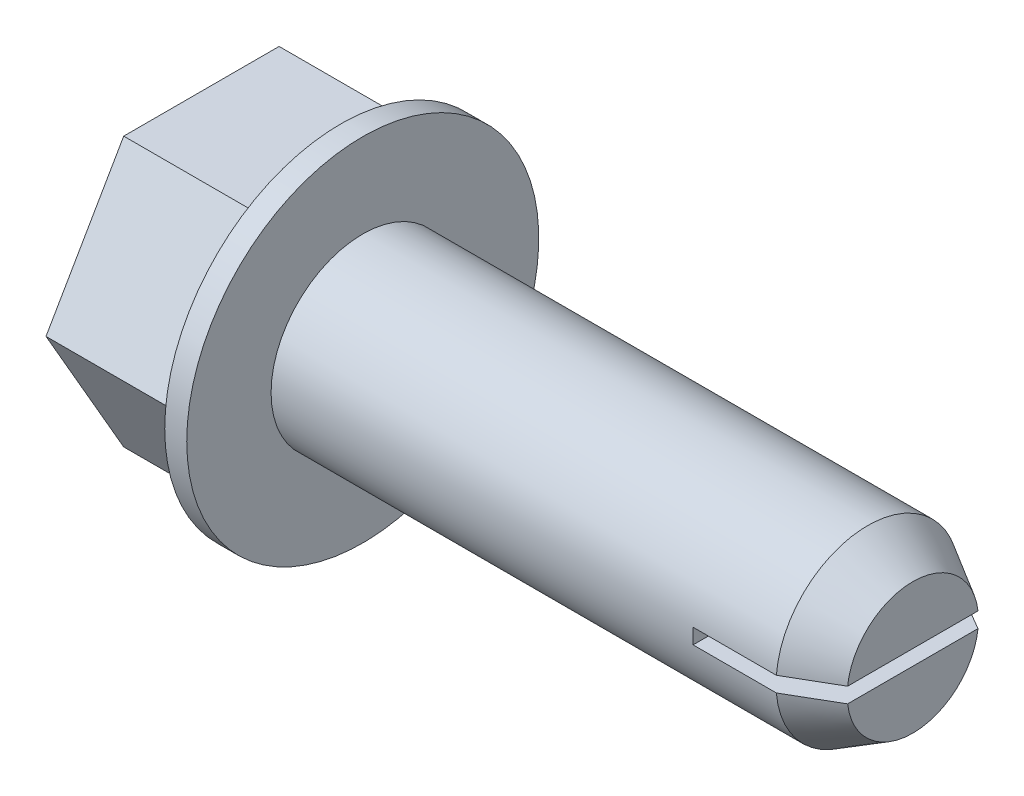
from build123d import *

# Parameters (mm, degrees)
EXTRUDE1_REACH                 = 28.103
POINT_CUT_EXTRUDE10_DEPTH      = 21.909924247
POINT_CUT_EXTRUDE10_DEPTH_BACK = 21.909924247
SKETCH13_W                     = 4.445
SKETCH13_H                     = 0.529166666


with BuildPart() as part:
    # Sketch1 → base-Revolve (revolve)
    with BuildSketch(Plane.XY, mode=Mode.PRIVATE) as base_revolve_sk:
        Polygon((0, 6.096), (-0.762, 6.096), (-0.762, 4.6609), (-5.588, 4.6609), (-5.588, 3.72872), (-4.6228, 3.72872), (-4.6228, 0), (0, 0), (19.05, 0), (19.05, 3.175), (0, 3.175), align=None)
    revolve(base_revolve_sk.sketch.rotate(Axis((0, 0, 0), (1, 0, 0)), 90), axis=Axis((0, 0, 0), (1, 0, 0)))

    # Sketch15 → Extrude1 (add, up to next)
    with BuildSketch(Plane.ZY.offset(5.588), mode=Mode.PRIVATE) as extrude1_sk1:
        with BuildLine():
            ThreePointArc((-4.036457824, -2.330449967), (-4.6609, 3.6e-08), (-4.036457787, 2.33045003))
            Line((-4.036457787, 2.33045003), (-5.381943739, 0))
            Line((-5.381943739, 0), (-4.036457824, -2.330449967))
        make_face()
    extrude1_tool1 = extrude(extrude1_sk1.sketch, amount=-EXTRUDE1_REACH, mode=Mode.PRIVATE) - part.part
    # Sketch15 → Extrude1 (add, up to next)
    with BuildSketch(Plane.ZY.offset(5.588), mode=Mode.PRIVATE) as extrude1_sk2:
        with BuildLine():
            ThreePointArc((-4.036457787, 2.33045003), (-2.330449985, 4.036457813), (0, 4.6609))
            Line((0, 4.6609), (-2.69097187, 4.6609))
            Line((-2.69097187, 4.6609), (-4.036457787, 2.33045003))
        make_face()
    extrude1_tool2 = extrude(extrude1_sk2.sketch, amount=-EXTRUDE1_REACH, mode=Mode.PRIVATE) - part.part
    # Sketch15 → Extrude1 (add, up to next)
    with BuildSketch(Plane.ZY.offset(5.588), mode=Mode.PRIVATE) as extrude1_sk3:
        with BuildLine():
            ThreePointArc((0, 4.6609), (2.330450001, 4.036457804), (4.036457805, 2.330449998))
            Line((4.036457805, 2.330449998), (2.69097187, 4.6609))
            Line((2.69097187, 4.6609), (0, 4.6609))
        make_face()
    extrude1_tool3 = extrude(extrude1_sk3.sketch, amount=-EXTRUDE1_REACH, mode=Mode.PRIVATE) - part.part
    # Sketch15 → Extrude1 (add, up to next)
    with BuildSketch(Plane.ZY.offset(5.588), mode=Mode.PRIVATE) as extrude1_sk4:
        with BuildLine():
            Line((4.036457776, -2.330450049), (5.381943739, 0))
            Line((5.381943739, 0), (4.036457805, 2.330449998))
            ThreePointArc((4.036457805, 2.330449998), (4.502083684, 1.206329686), (4.6609, 0))
            ThreePointArc((4.6609, 0), (4.502083676, -1.206329715), (4.036457776, -2.330450049))
        make_face()
    extrude1_tool4 = extrude(extrude1_sk4.sketch, amount=-EXTRUDE1_REACH, mode=Mode.PRIVATE) - part.part
    # Sketch15 → Extrude1 (add, up to next)
    with BuildSketch(Plane.ZY.offset(5.588), mode=Mode.PRIVATE) as extrude1_sk5:
        with BuildLine():
            Line((2.69097187, -4.6609), (4.036457776, -2.330450049))
            ThreePointArc((4.036457776, -2.330450049), (2.330449975, -4.036457819), (0, -4.6609))
            Line((0, -4.6609), (2.69097187, -4.6609))
        make_face()
    extrude1_tool5 = extrude(extrude1_sk5.sketch, amount=-EXTRUDE1_REACH, mode=Mode.PRIVATE) - part.part
    # Sketch15 → Extrude1 (add, up to next)
    with BuildSketch(Plane.ZY.offset(5.588), mode=Mode.PRIVATE) as extrude1_sk6:
        with BuildLine():
            Line((-2.69097187, -4.6609), (0, -4.6609))
            ThreePointArc((0, -4.6609), (-2.330450017, -4.036457795), (-4.036457824, -2.330449967))
            Line((-4.036457824, -2.330449967), (-2.69097187, -4.6609))
        make_face()
    extrude1_tool6 = extrude(extrude1_sk6.sketch, amount=-EXTRUDE1_REACH, mode=Mode.PRIVATE) - part.part
    add(extrude1_tool1.solids().sort_by_distance((-5.588, 0, -4.817334))[0])
    add(extrude1_tool2.solids().sort_by_distance((-5.588, 4.171933, -2.408667))[0])
    add(extrude1_tool3.solids().sort_by_distance((-5.588, 4.171933, 2.408667))[0])
    add(extrude1_tool4.solids().sort_by_distance((-5.588, 0, 4.817334))[0])
    add(extrude1_tool5.solids().sort_by_distance((-5.588, -4.171933, 2.408667))[0])
    add(extrude1_tool6.solids().sort_by_distance((-5.588, -4.171933, -2.408667))[0])

    # Sketch8 → point_Cut-Revolve1 (revolve, cut)
    with BuildSketch(Plane.XY, mode=Mode.PRIVATE) as point_cut_revolve1_sk:
        Polygon((19.05, 0), (19.558, 0), (19.558, 3.683), (17.488209787, 3.683), (17.488209787, 3.175), (19.05, 2.2733), align=None)
    revolve(point_cut_revolve1_sk.sketch.rotate(Axis((0, 0, 0), (1, 0, 0)), 90), axis=Axis((0, 0, 0), (1, 0, 0)), mode=Mode.SUBTRACT)

    # Sketch13 → point_Cut-Extrude10 (cut, two sides: drawn at the far end of the back side and taken through both)
    with BuildSketch(Plane.XY.offset(-POINT_CUT_EXTRUDE10_DEPTH_BACK)):
        with Locations((16.8275, 0)):
            Rectangle(SKETCH13_W, SKETCH13_H)
    extrude(amount=POINT_CUT_EXTRUDE10_DEPTH + POINT_CUT_EXTRUDE10_DEPTH_BACK, mode=Mode.SUBTRACT)


solid = part.part
